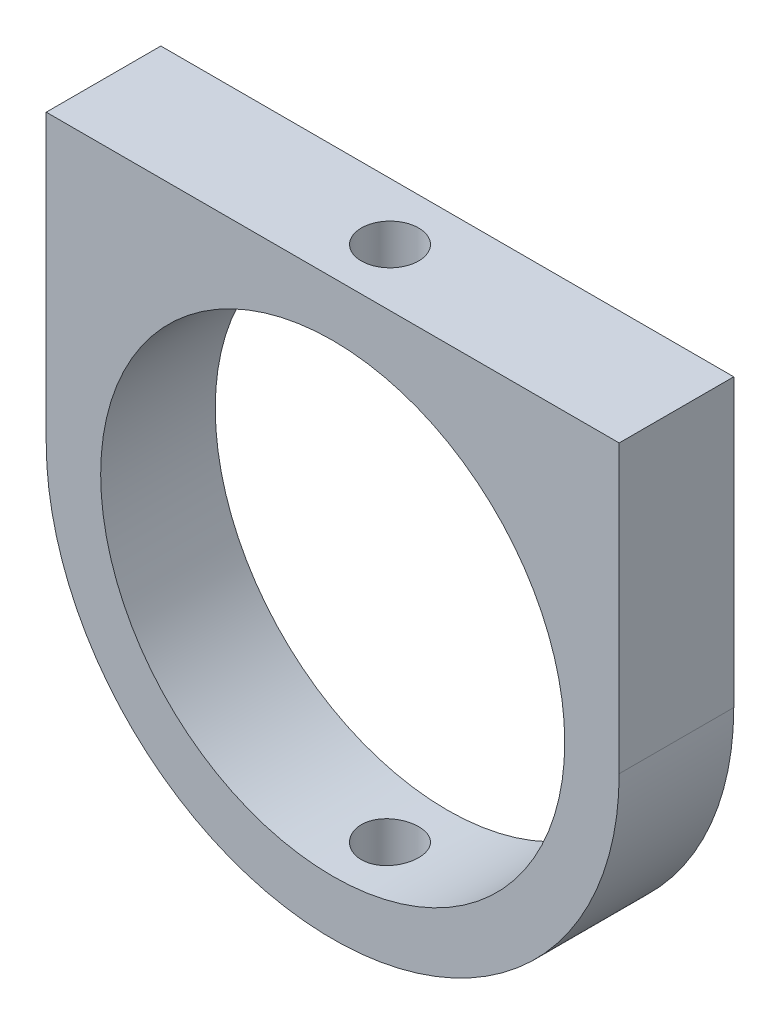
from build123d import *

# Parameters (mm, degrees)
SKETCH1_R           = 8.1
BOSS_EXTRUDE1_DEPTH = 4
SKETCH3_R           = 1
CUT_EXTRUDE1_DEPTH  = 20


with BuildPart() as part:
    # Sketch1 → Boss-Extrude1 (new body)
    with BuildSketch(Plane.XY):
        with BuildLine():
            ThreePointArc((-10, 0), (-7.071067812, -7.071067812), (0, -10))
            ThreePointArc((0, -10), (7.071067812, -7.071067812), (10, 0))
            Line((10, 0), (10, 10))
            Line((10, 10), (-10, 10))
            Line((-10, 10), (-10, 0))
        make_face()
        Circle(SKETCH1_R, mode=Mode.SUBTRACT)
    extrude(amount=BOSS_EXTRUDE1_DEPTH)

    # Sketch3 → Cut-Extrude1 (cut)
    with BuildSketch(Plane(origin=(0, 10, 0), x_dir=(1, 0, 0), z_dir=(0, 1, 0))):
        with Locations(Location((0, -2, 0), (0, 0, 270))):
            Circle(SKETCH3_R)
    extrude(amount=-CUT_EXTRUDE1_DEPTH, mode=Mode.SUBTRACT)


solid = part.part
